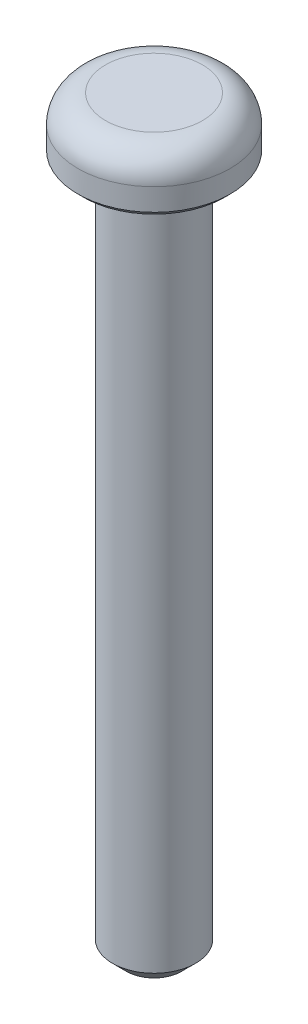
from build123d import *

# Parameters (mm, degrees)
FILLET1_R     = 1
CHAMFER1_SIZE = 0.5
CHAMFER2_SIZE = 0.2


with BuildPart() as part:
    # Sketch1 → Revolve1 (revolve)
    with BuildSketch(Plane.XY, mode=Mode.PRIVATE) as revolve1_sk:
        Polygon((0, 0), (0, 27), (2.75, 27), (2.75, 25), (1.5, 25), (1.5, 0), align=None)
    revolve(revolve1_sk.sketch.rotate(Axis((0, 0, 0), (0, 1, 0)), 90), axis=Axis((0, 0, 0), (0, 1, 0)))

    # Fillet1
    fillet1_edges = [part.edges().sort_by_distance(p)[0] for p in [
        (0, 27, 2.75),
    ]]
    fillet(fillet1_edges, radius=FILLET1_R)

    # Chamfer1
    chamfer1_edges = [part.edges().sort_by_distance(p)[0] for p in [
        (0, 0, 1.5),
    ]]
    chamfer(chamfer1_edges, length=CHAMFER1_SIZE)

    # Chamfer2
    chamfer2_edges = [part.edges().sort_by_distance(p)[0] for p in [
        (0, 25, 2.75),
    ]]
    chamfer(chamfer2_edges, length=CHAMFER2_SIZE)


solid = part.part
